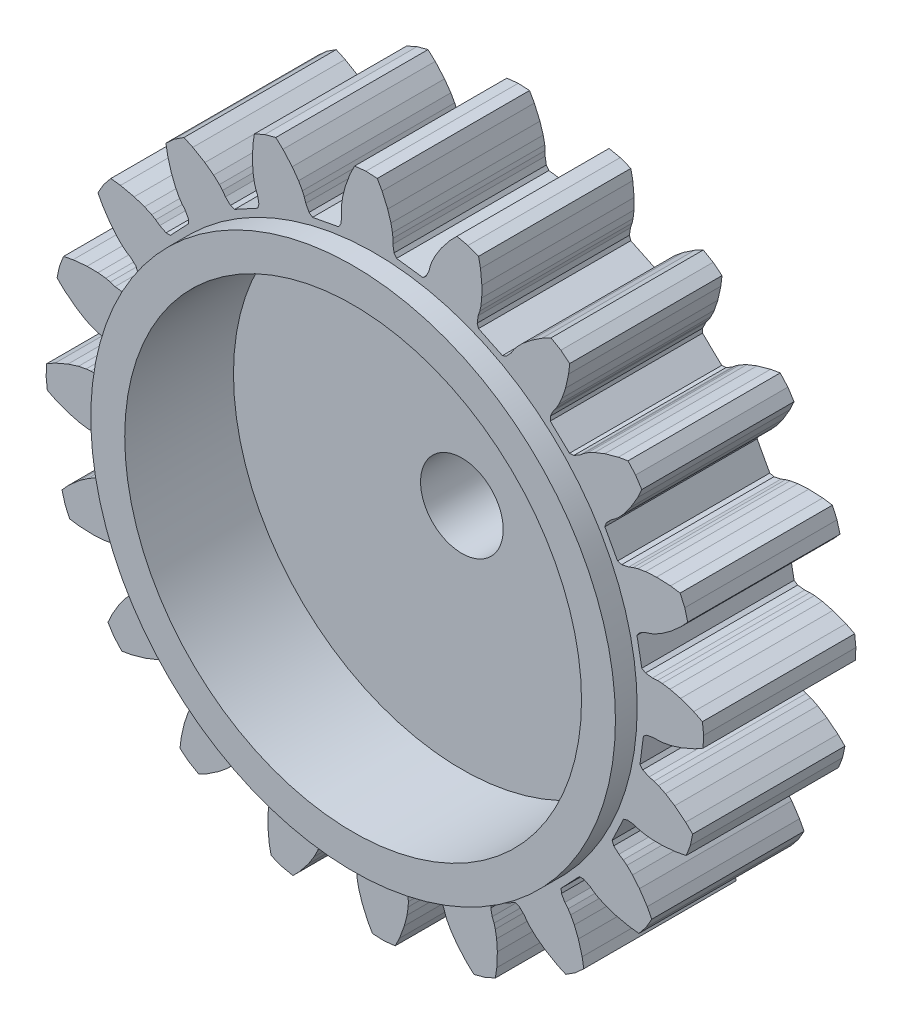
from build123d import *

# Parameters (mm, degrees)
SKETCH3_R               = 12.06
SKETCH3_R_2             = 10.5
BOSS_EXTRUDE1_DEPTH     = 1
BOSS_EXTRUDE2_DEPTH     = 7
CUT_EXTRUDE1_DEPTH      = 23.490775543
CUT_EXTRUDE1_DEPTH_BACK = 23.490775543
SKETCH6_R               = 1.9
CUT_EXTRUDE2_START      = -4
SKETCH8_R               = 10.5
CUT_EXTRUDE2_DEPTH      = 4


with BuildPart() as part:
    # Sketch3 → Boss-Extrude1 (new body)
    with BuildSketch(Plane.XY):
        Circle(SKETCH3_R)
        Circle(SKETCH3_R_2, mode=Mode.SUBTRACT)
    extrude(amount=BOSS_EXTRUDE1_DEPTH)

    # Sketch5 → Boss-Extrude2 (add)
    with BuildSketch(Plane.XY):
        Polygon((12.272366484, 1.667700681), (12.049023389, 2.865875091), (12.168178926, 3.025489099), (12.453967934, 3.1758722), (12.675624585, 3.245507867), (12.874175581, 3.331595795), (13.186953075, 3.508129235), (13.595862175, 3.799162506), (14.079118573, 4.225819847), (14.382598395, 4.556321823), (14.24667793, 5.061505499), (14.033402734, 5.539206881), (13.589428475, 5.604156216), (12.945308459, 5.630283557), (12.44443837, 5.598093941), (12.09039192, 5.537720709), (11.882031747, 5.479242786), (11.666125064, 5.393422617), (11.349516334, 5.329788143), (11.156366263, 5.378447404), (10.573698103, 6.448962173), (10.637698311, 6.637585201), (10.863028876, 6.86892169), (11.052318274, 7.003644817), (11.214548859, 7.146874934), (11.4574661, 7.411421773), (11.756427538, 7.814570723), (12.084187314, 8.369680407), (12.27068305, 8.777786888), (11.985304665, 9.216243381), (11.634850054, 9.604658733), (11.192534994, 9.52923363), (10.571866663, 9.355038177), (10.10545804, 9.169646664), (9.787396211, 9.002821938), (9.607304583, 8.882819294), (9.428485015, 8.734480629), (9.147036353, 8.576123169), (8.948303181, 8.562714222), (8.063345575, 9.400779905), (8.065925668, 9.599948217), (8.208740864, 9.889593266), (8.347134043, 10.076216215), (8.457163958, 10.262568159), (8.606442514, 10.58923271), (8.766191861, 11.065034311), (8.906371606, 11.694258334), (8.957627753, 12.140021013), (8.550726272, 12.468831148), (8.097397186, 12.729939669), (7.700038205, 12.521523262), (7.1635769, 12.16405648), (6.777285067, 11.843610482), (6.526341968, 11.586664229), (6.392147508, 11.416883558), (6.267919162, 11.220546819), (6.049180723, 10.982967506), (5.864317838, 10.908802912), (4.763696601, 11.432383801), (4.704604023, 11.622601415), (4.750924102, 11.942202549), (4.824874175, 12.162457364), (4.871932925, 12.373689709), (4.91296037, 12.730495769), (4.917860247, 13.232375245), (4.856738191, 13.874120776), (4.76773744, 14.313905297), (4.279143216, 14.500882846), (3.767314664, 14.609125415), (3.453808027, 14.288118955), (3.054066318, 13.782372182), (2.785704213, 13.358239187), (2.626443902, 13.036323096), (2.551282498, 12.833383714), (2.493805709, 12.608267709), (2.359189137, 12.31472246), (2.206292205, 12.187061967), (0.997743813, 12.344906316), (0.882762956, 12.507553407), (0.828053788, 12.825825839), (0.830322005, 13.058152446), (0.809803152, 13.273588297), (0.738563435, 13.625609204), (0.588134208, 14.104439095), (0.331693402, 14.69588761), (0.111147767, 15.0866448), (-0.411312194, 15.113487098), (-0.931538866, 15.058268177), (-1.130504945, 14.656094014), (-1.354397555, 14.051573268), (-1.47856078, 13.565270368), (-1.530548794, 13.209895829), (-1.539319818, 12.993662857), (-1.524418822, 12.761803509), (-1.561736319, 12.441026579), (-1.667700681, 12.272366484), (-2.865875091, 12.049023389), (-3.025489099, 12.168178926), (-3.1758722, 12.453967934), (-3.245507867, 12.675624585), (-3.331595795, 12.874175581), (-3.508129235, 13.186953075), (-3.799162506, 13.595862175), (-4.225819847, 14.079118573), (-4.556321823, 14.382598395), (-5.061505499, 14.24667793), (-5.539206881, 14.033402734), (-5.604156216, 13.589428475), (-5.630283557, 12.945308459), (-5.598093941, 12.44443837), (-5.537720709, 12.09039192), (-5.479242786, 11.882031747), (-5.393422617, 11.666125064), (-5.329788143, 11.349516334), (-5.378447404, 11.156366263), (-6.448962173, 10.573698103), (-6.637585201, 10.637698311), (-6.86892169, 10.863028876), (-7.003644817, 11.052318274), (-7.146874934, 11.214548859), (-7.411421773, 11.4574661), (-7.814570723, 11.756427538), (-8.369680407, 12.084187314), (-8.777786888, 12.27068305), (-9.216243381, 11.985304665), (-9.604658733, 11.634850054), (-9.52923363, 11.192534994), (-9.355038177, 10.571866663), (-9.169646664, 10.10545804), (-9.002821938, 9.787396211), (-8.882819294, 9.607304583), (-8.734480629, 9.428485015), (-8.576123169, 9.147036353), (-8.562714222, 8.948303181), (-9.400779905, 8.063345575), (-9.599948217, 8.065925668), (-9.889593266, 8.208740864), (-10.076216215, 8.347134043), (-10.262568159, 8.457163958), (-10.58923271, 8.606442514), (-11.065034311, 8.766191861), (-11.694258334, 8.906371606), (-12.140021013, 8.957627753), (-12.468831148, 8.550726272), (-12.729939669, 8.097397186), (-12.521523262, 7.700038205), (-12.16405648, 7.1635769), (-11.843610482, 6.777285067), (-11.586664229, 6.526341968), (-11.416883558, 6.392147508), (-11.220546819, 6.267919162), (-10.982967506, 6.049180723), (-10.908802912, 5.864317838), (-11.432383801, 4.763696601), (-11.622601415, 4.704604023), (-11.942202549, 4.750924102), (-12.162457364, 4.824874175), (-12.373689709, 4.871932925), (-12.730495769, 4.91296037), (-13.232375245, 4.917860247), (-13.874120776, 4.856738191), (-14.313905297, 4.76773744), (-14.500882846, 4.279143216), (-14.609125415, 3.767314664), (-14.288118955, 3.453808027), (-13.782372182, 3.054066318), (-13.358239187, 2.785704213), (-13.036323096, 2.626443902), (-12.833383714, 2.551282498), (-12.608267709, 2.493805709), (-12.31472246, 2.359189137), (-12.187061967, 2.206292205), (-12.344906316, 0.997743813), (-12.507553407, 0.882762956), (-12.825825839, 0.828053788), (-13.058152446, 0.830322005), (-13.273588297, 0.809803152), (-13.625609204, 0.738563435), (-14.104439095, 0.588134208), (-14.69588761, 0.331693402), (-15.0866448, 0.111147767), (-15.113487098, -0.411312194), (-15.058268177, -0.931538866), (-14.656094014, -1.130504945), (-14.051573268, -1.354397555), (-13.565270368, -1.47856078), (-13.209895829, -1.530548794), (-12.993662857, -1.539319818), (-12.761803509, -1.524418822), (-12.441026579, -1.561736319), (-12.272366484, -1.667700681), (-12.049023389, -2.865875091), (-12.168178926, -3.025489099), (-12.453967934, -3.1758722), (-12.675624585, -3.245507867), (-12.874175581, -3.331595795), (-13.186953075, -3.508129235), (-13.595862175, -3.799162506), (-14.079118573, -4.225819847), (-14.382598395, -4.556321823), (-14.24667793, -5.061505499), (-14.033402734, -5.539206881), (-13.589428475, -5.604156216), (-12.945308459, -5.630283557), (-12.44443837, -5.598093941), (-12.09039192, -5.537720709), (-11.882031747, -5.479242786), (-11.666125064, -5.393422617), (-11.349516334, -5.329788143), (-11.156366263, -5.378447404), (-10.573698103, -6.448962173), (-10.637698311, -6.637585201), (-10.863028876, -6.86892169), (-11.052318274, -7.003644817), (-11.214548859, -7.146874934), (-11.4574661, -7.411421773), (-11.756427538, -7.814570723), (-12.084187314, -8.369680407), (-12.27068305, -8.777786888), (-11.985304665, -9.216243381), (-11.634850054, -9.604658733), (-11.192534994, -9.52923363), (-10.571866663, -9.355038177), (-10.10545804, -9.169646664), (-9.787396211, -9.002821938), (-9.607304583, -8.882819294), (-9.428485015, -8.734480629), (-9.147036353, -8.576123169), (-8.948303181, -8.562714222), (-8.063345575, -9.400779905), (-8.065925668, -9.599948217), (-8.208740864, -9.889593266), (-8.347134043, -10.076216215), (-8.457163958, -10.262568159), (-8.606442514, -10.58923271), (-8.766191861, -11.065034311), (-8.906371606, -11.694258334), (-8.957627753, -12.140021013), (-8.550726272, -12.468831148), (-8.097397186, -12.729939669), (-7.700038205, -12.521523262), (-7.1635769, -12.16405648), (-6.777285067, -11.843610482), (-6.526341968, -11.586664229), (-6.392147508, -11.416883558), (-6.267919162, -11.220546819), (-6.049180723, -10.982967506), (-5.864317838, -10.908802912), (-4.763696601, -11.432383801), (-4.704604023, -11.622601415), (-4.750924102, -11.942202549), (-4.824874175, -12.162457364), (-4.871932925, -12.373689709), (-4.91296037, -12.730495769), (-4.917860247, -13.232375245), (-4.856738191, -13.874120776), (-4.76773744, -14.313905297), (-4.279143216, -14.500882846), (-3.767314664, -14.609125415), (-3.453808027, -14.288118955), (-3.054066318, -13.782372182), (-2.785704213, -13.358239187), (-2.626443902, -13.036323096), (-2.551282498, -12.833383714), (-2.493805709, -12.608267709), (-2.359189137, -12.31472246), (-2.206292205, -12.187061967), (-0.997743813, -12.344906316), (-0.882762956, -12.507553407), (-0.828053788, -12.825825839), (-0.830322005, -13.058152446), (-0.809803152, -13.273588297), (-0.738563435, -13.625609204), (-0.588134208, -14.104439095), (-0.331693402, -14.69588761), (-0.111147767, -15.0866448), (0.411312194, -15.113487098), (0.931538866, -15.058268177), (1.130504945, -14.656094014), (1.354397555, -14.051573268), (1.47856078, -13.565270368), (1.530548794, -13.209895829), (1.539319818, -12.993662857), (1.524418822, -12.761803509), (1.561736319, -12.441026579), (1.667700681, -12.272366484), (2.865875091, -12.049023389), (3.025489099, -12.168178926), (3.1758722, -12.453967934), (3.245507867, -12.675624585), (3.331595795, -12.874175581), (3.508129235, -13.186953075), (3.799162506, -13.595862175), (4.225819847, -14.079118573), (4.556321823, -14.382598395), (5.061505499, -14.24667793), (5.539206881, -14.033402734), (5.604156216, -13.589428475), (5.630283557, -12.945308459), (5.598093941, -12.44443837), (5.537720709, -12.09039192), (5.479242786, -11.882031747), (5.393422617, -11.666125064), (5.329788143, -11.349516334), (5.378447404, -11.156366263), (6.448962173, -10.573698103), (6.637585201, -10.637698311), (6.86892169, -10.863028876), (7.003644817, -11.052318274), (7.146874934, -11.214548859), (7.411421773, -11.4574661), (7.814570723, -11.756427538), (8.369680407, -12.084187314), (8.777786888, -12.27068305), (9.216243381, -11.985304665), (9.604658733, -11.634850054), (9.52923363, -11.192534994), (9.355038177, -10.571866663), (9.169646664, -10.10545804), (9.002821938, -9.787396211), (8.882819294, -9.607304583), (8.734480629, -9.428485015), (8.576123169, -9.147036353), (8.562714222, -8.948303181), (9.400779905, -8.063345575), (9.599948217, -8.065925668), (9.889593266, -8.208740864), (10.076216215, -8.347134043), (10.262568159, -8.457163958), (10.58923271, -8.606442514), (11.065034311, -8.766191861), (11.694258334, -8.906371606), (12.140021013, -8.957627753), (12.468831148, -8.550726272), (12.729939669, -8.097397186), (12.521523262, -7.700038205), (12.16405648, -7.1635769), (11.843610482, -6.777285067), (11.586664229, -6.526341968), (11.416883558, -6.392147508), (11.220546819, -6.267919162), (10.982967506, -6.049180723), (10.908802912, -5.864317838), (11.432383801, -4.763696601), (11.622601415, -4.704604023), (11.942202549, -4.750924102), (12.162457364, -4.824874175), (12.373689709, -4.871932925), (12.730495769, -4.91296037), (13.232375245, -4.917860247), (13.874120776, -4.856738191), (14.313905297, -4.76773744), (14.500882846, -4.279143216), (14.609125415, -3.767314664), (14.288118955, -3.453808027), (13.782372182, -3.054066318), (13.358239187, -2.785704213), (13.036323096, -2.626443902), (12.833383714, -2.551282498), (12.608267709, -2.493805709), (12.31472246, -2.359189137), (12.187061967, -2.206292205), (12.344906316, -0.997743813), (12.507553407, -0.882762956), (12.825825839, -0.828053788), (13.058152446, -0.830322005), (13.273588297, -0.809803152), (13.625609204, -0.738563435), (14.104439095, -0.588134208), (14.69588761, -0.331693402), (15.0866448, -0.111147767), (15.113487098, 0.411312194), (15.058268177, 0.931538866), (14.656094014, 1.130504945), (14.051573268, 1.354397555), (13.565270368, 1.47856078), (13.209895829, 1.530548794), (12.993662857, 1.539319818), (12.761803509, 1.524418822), (12.441026579, 1.561736319), align=None)
    extrude(amount=-BOSS_EXTRUDE2_DEPTH)

    # Sketch6 → Cut-Extrude1 (cut, two sides: drawn at the far end of the back side and taken through both)
    with BuildSketch(Plane.XY.offset(-CUT_EXTRUDE1_DEPTH_BACK)):
        Circle(SKETCH6_R)
    extrude(amount=CUT_EXTRUDE1_DEPTH + CUT_EXTRUDE1_DEPTH_BACK, mode=Mode.SUBTRACT)

    # Sketch8 → Cut-Extrude2 (cut)
    with BuildSketch(Plane.XY.offset(CUT_EXTRUDE2_START)):
        Circle(SKETCH8_R)
    extrude(amount=CUT_EXTRUDE2_DEPTH, mode=Mode.SUBTRACT)


solid = part.part
